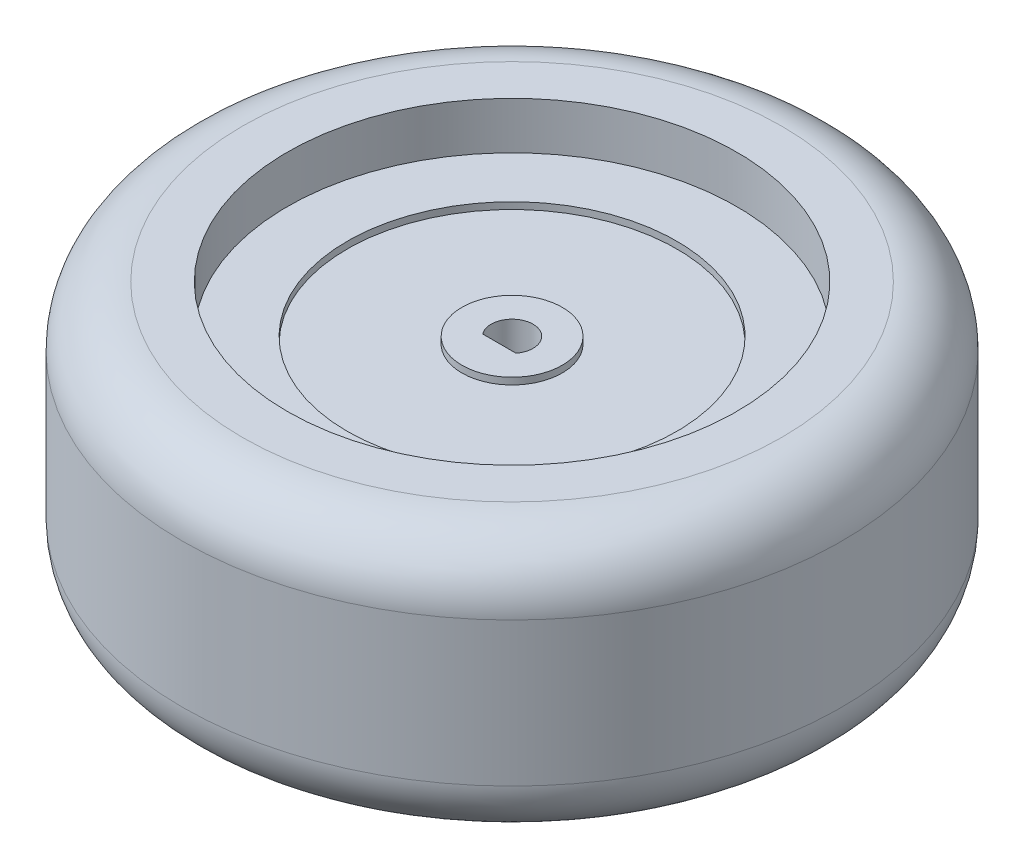
from build123d import *
from build123d.topology import SkipClean

# Parameters (mm, degrees)
SKETCH1_R           = 22
BOSS_EXTRUDE1_DEPTH = 17.6
SKETCH2_R           = 15
CUT_EXTRUDE1_DEPTH  = 3.6
CUT_EXTRUDE2_DEPTH  = 37.18
BOSS_EXTRUDE2_START = 0.45
SKETCH4_R           = 15
SKETCH4_R_2         = 11
SKETCH4_R_3         = 3.35
BOSS_EXTRUDE2_DEPTH = 0.45
SKETCH5_R           = 10.75
CUT_EXTRUDE3_DEPTH  = 9
FILLET1_R           = 4


with BuildPart() as part:
    # Sketch1 → Boss-Extrude1 (new body)
    with BuildSketch(Plane(origin=(0, 0, 0), x_dir=(1, 0, 0), z_dir=(0, 1, 0))):
        with Locations(Location((0, 0, 0), (0, 0, 270))):
            Circle(SKETCH1_R)
    extrude(amount=BOSS_EXTRUDE1_DEPTH)

    # Sketch2 → Cut-Extrude1 (cut)
    with BuildSketch(Plane(origin=(0, 17.6, 0), x_dir=(1, 0, 0), z_dir=(0, 1, 0))):
        with Locations(Location((0, 0, 0), (0, 0, 270))):
            Circle(SKETCH2_R)
    extrude(amount=-CUT_EXTRUDE1_DEPTH, mode=Mode.SUBTRACT)

    # Sketch3 → Cut-Extrude2 (cut)
    with BuildSketch(Plane(origin=(0, 14, 0), x_dir=(1, 0, 0), z_dir=(0, 1, 0))):
        with BuildLine():
            ThreePointArc((1.4, 0), (-0.448663748, 1.326160187), (-1.112429773, -0.85))
            Line((-1.112429773, -0.85), (1.112429773, -0.85))
            ThreePointArc((1.112429773, -0.85), (1.326160187, -0.448663748), (1.4, 0))
        make_face()
    extrude(amount=-CUT_EXTRUDE2_DEPTH, mode=Mode.SUBTRACT)

    # Sketch4 → Boss-Extrude2 (add)
    # profile 1 of 2: a face of its own
    with SkipClean():  # the faces are left unmerged after this step: merging them gives an invalid solid
        with BuildSketch(Plane(origin=(0, 14, 0), x_dir=(1, 0, 0), z_dir=(0, 1, 0)).offset(BOSS_EXTRUDE2_START)):
            with Locations(Location((0, 0, 0), (0, 0, 270))):
                Circle(SKETCH4_R)
            with Locations(Location((0, 0, 0), (0, 0, 270))):
                Circle(SKETCH4_R_2, mode=Mode.SUBTRACT)
        # profile 2 of 2: a face of its own
        with BuildSketch(Plane(origin=(0, 14, 0), x_dir=(1, 0, 0), z_dir=(0, 1, 0)).offset(BOSS_EXTRUDE2_START)):
            with Locations(Location((0, 0, 0), (0, 0, 270))):
                Circle(SKETCH4_R_3)
            with BuildLine():
                Line((1.112429773, -0.85), (-1.112429773, -0.85))
                ThreePointArc((-1.112429773, -0.85), (0, 1.4), (1.112429773, -0.85))
            make_face(mode=Mode.SUBTRACT)
        extrude(amount=-BOSS_EXTRUDE2_DEPTH)

    # Sketch5 → Cut-Extrude3 (cut)
    with SkipClean():  # the faces are left unmerged after this step: merging them gives an invalid solid
        with BuildSketch(Plane.XZ):
            with Locations(Location((0, 0, 0), (0, 0, 270))):
                Circle(SKETCH5_R)
        extrude(amount=-CUT_EXTRUDE3_DEPTH, mode=Mode.SUBTRACT)

    # Fillet1
    fillet1_edges = [part.edges().sort_by_distance(p)[0] for p in [
        (0, 0, -22),
        (0, 17.6, -22),
    ]]
    fillet(fillet1_edges, radius=FILLET1_R)


solid = part.part
